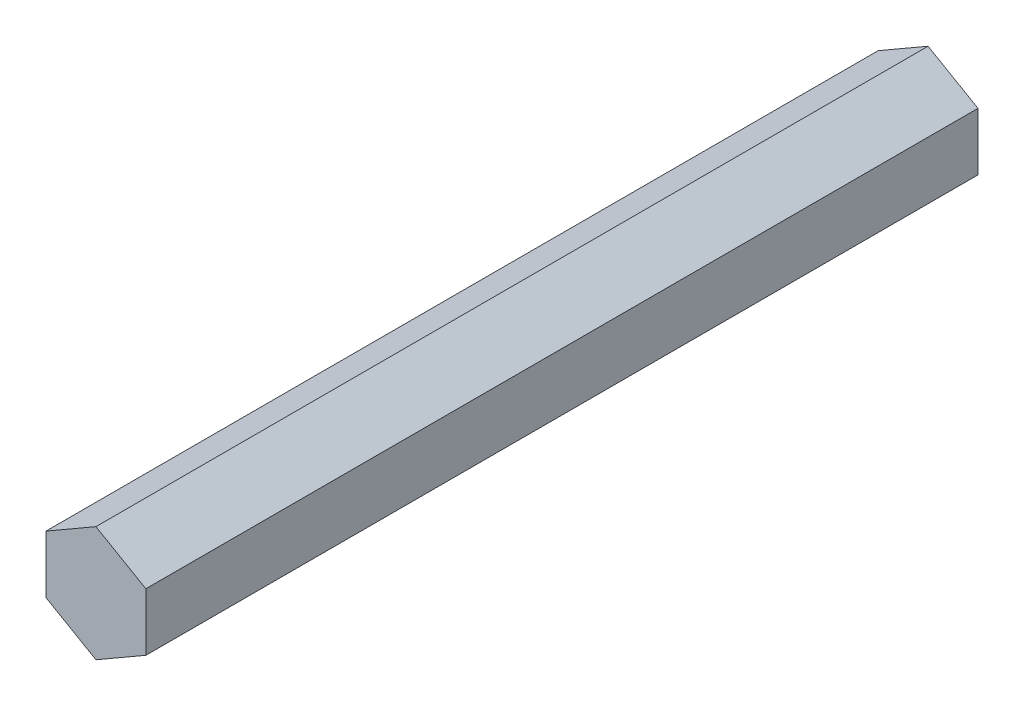
from build123d import *

# Parameters (mm, degrees)
BOSS_EXTRUDE1_DEPTH = 79.375


with BuildPart() as part:
    # Sketch1 → Boss-Extrude1 (new body)
    with BuildSketch(Plane.XY):
        Polygon((0, 5.499261314), (-4.7625, 2.749630657), (-4.7625, -2.749630657), (0, -5.499261314), (4.7625, -2.749630657), (4.7625, 2.749630657), align=None)
    extrude(amount=BOSS_EXTRUDE1_DEPTH)


solid = part.part
